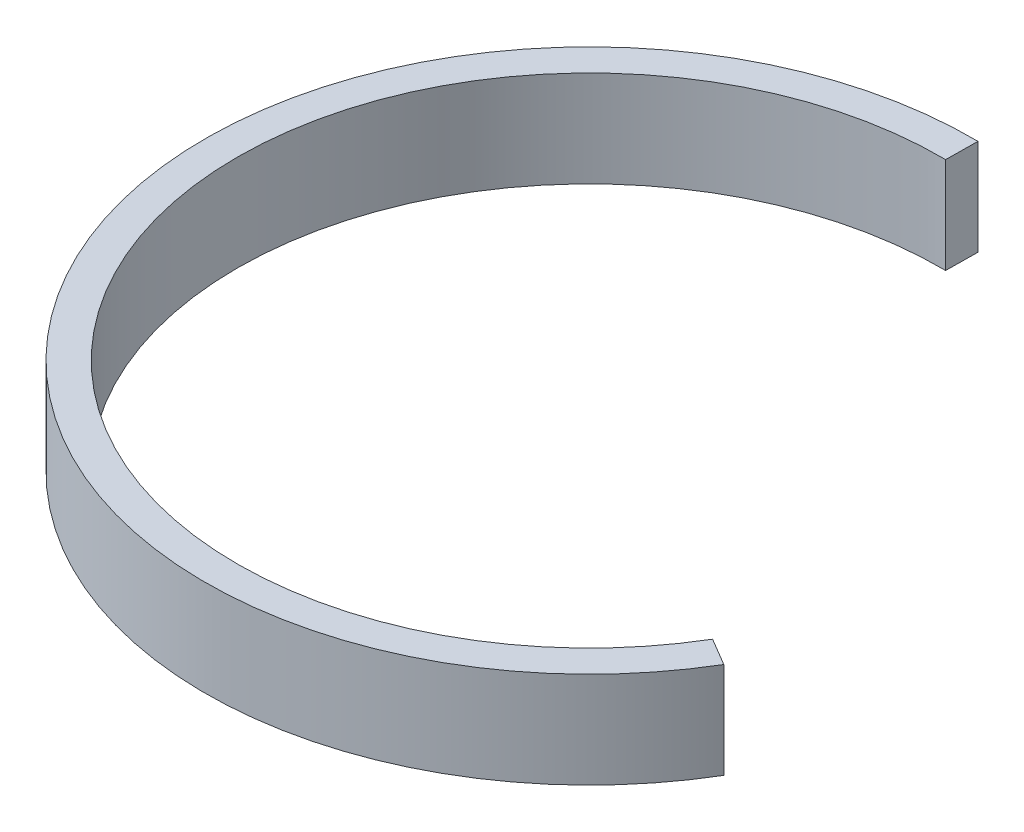
from build123d import *

# Parameters (mm, degrees)
BOSS_EXTRUDE1_DEPTH = 30


with BuildPart() as part:
    # Sketch1 → Boss-Extrude1 (new body)
    with BuildSketch(Plane(origin=(0, 0, 0), x_dir=(1, 0, 0), z_dir=(0, 1, 0))):
        with BuildLine():
            Line((1.287573032, 109.992464086), (1.404625125, 119.991779003))
            ThreePointArc((1.404625125, 119.991779003), (-104.618241424, -58.77944846), (103.213616299, -61.212330543))
            Line((103.213616299, -61.212330543), (94.612481607, -56.111302997))
            ThreePointArc((94.612481607, -56.111302997), (-95.900054639, -53.881161088), (1.287573032, 109.992464086))
        make_face()
    extrude(amount=BOSS_EXTRUDE1_DEPTH)


solid = part.part
